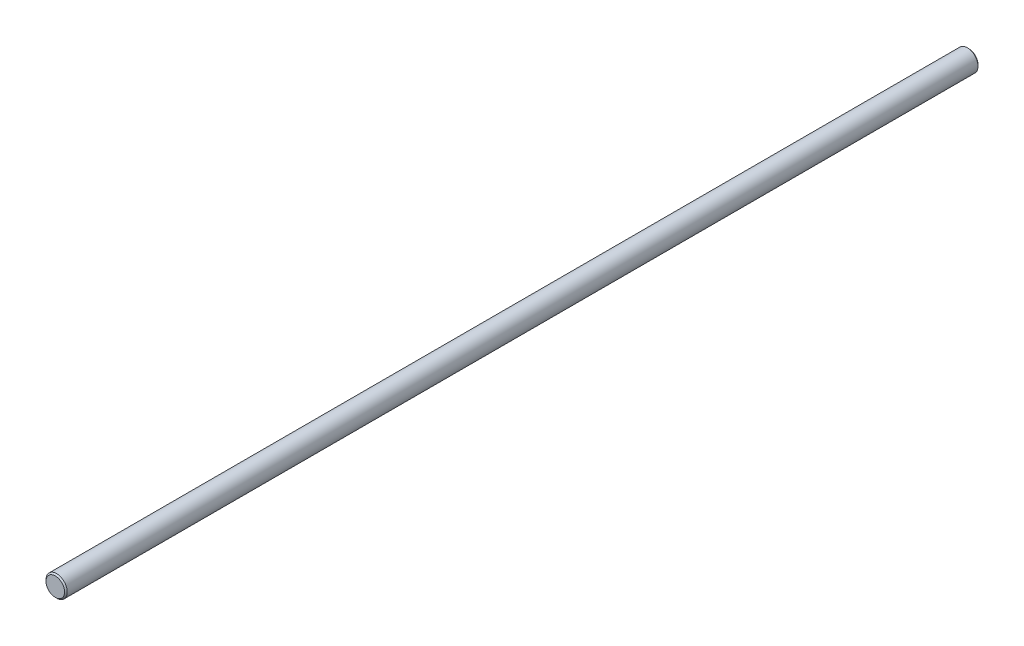
from build123d import *

# Parameters (mm, degrees)
CROQUIS1_R              = 4
SALIENTE_EXTRUIR1_DEPTH = 343.6
CHAFL_N1_SIZE           = 0.5


with BuildPart() as part:
    # Croquis1 → Saliente-Extruir1 (new body)
    with BuildSketch(Plane.XY):
        Circle(CROQUIS1_R)
    extrude(amount=-SALIENTE_EXTRUIR1_DEPTH)

    # Chaflán1
    chafl_n1_edges = [part.edges().sort_by_distance(p)[0] for p in [
        (-4, 0, 0),
        (-4, 0, -343.6),
    ]]
    chamfer(chafl_n1_edges, length=CHAFL_N1_SIZE)


solid = part.part
